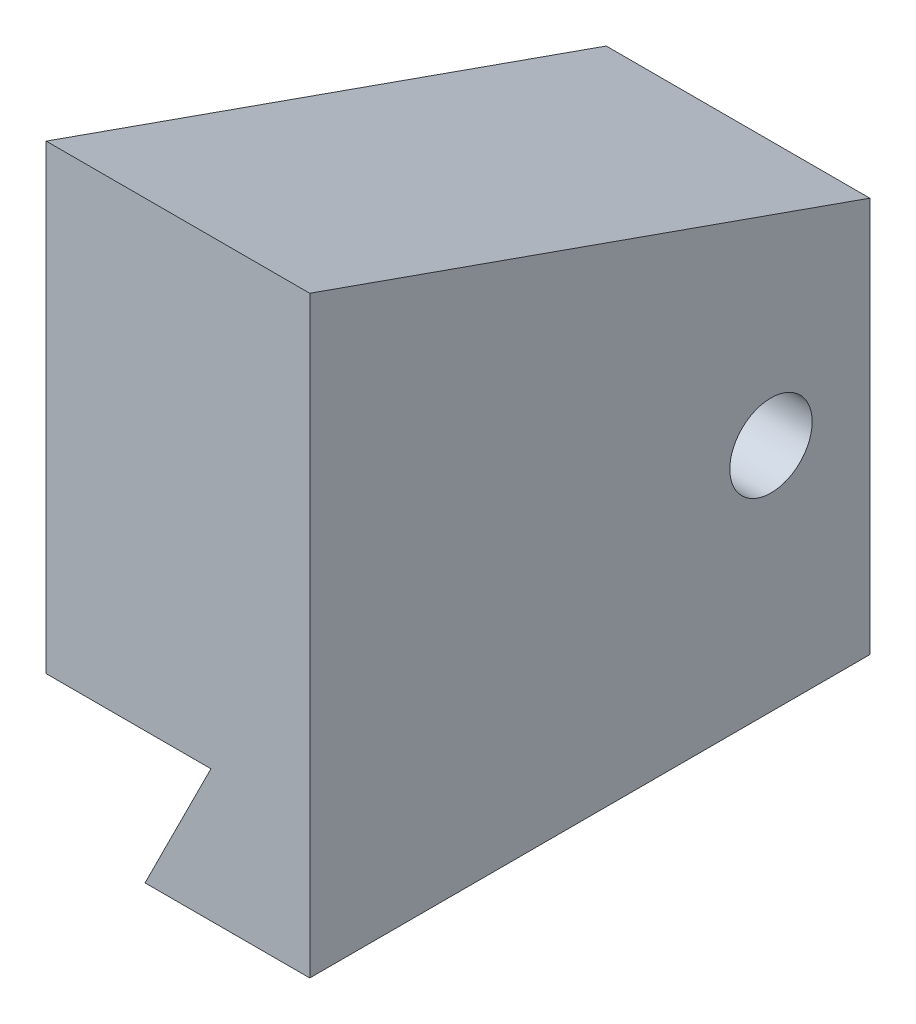
from build123d import *

# Parameters (mm, degrees)
BOSS_EXTRUDE1_DEPTH   = 8
CUT_EXTRUDE2_DEPTH    = 27.019223663
M3X0_5_TAPPED_HOLE1_D = 2.5
SKETCH7_W             = 20.825163494
SKETCH7_H             = 21.535112249
CUT_EXTRUDE3_DEPTH    = 8


with BuildPart() as part:
    # Sketch1 → Boss-Extrude1 (new body)
    with BuildSketch(Plane(origin=(0, 0, 0), x_dir=(0, 0, -1), z_dir=(1, 0, 0))):
        Polygon((0, 0), (0, 12), (-17, 18), (-17, 0), align=None)
    boss_extrude1 = extrude(amount=BOSS_EXTRUDE1_DEPTH)

    # Sketch3 → Cut-Extrude2 (cut, through all)
    with BuildSketch(Plane(origin=(0, 0, 0), x_dir=(-1, 0, 0), z_dir=(0, 0, -1))):
        Polygon((-8, 0), (-5, 0), (-3, 4), (-8, 4), align=None)
    cut_extrude2 = extrude(amount=-CUT_EXTRUDE2_DEPTH, mode=Mode.SUBTRACT)

    # M3x0.5 Tapped Hole1 (through all)
    with Locations(Plane(origin=(8, 7, 3), x_dir=(0, 0, 1), z_dir=(1, 0, 0))):
        with Locations((0, 0)):
            m3x0_5_tapped_hole1 = Hole(M3X0_5_TAPPED_HOLE1_D / 2)

    # Mirror1: Boss-Extrude1, Cut-Extrude2, M3x0.5 Tapped Hole1 across plane
    add(boss_extrude1.mirror(Plane(origin=(0, 0, 0), x_dir=(0, 0, 1), z_dir=(1, 0, 0))))
    add(cut_extrude2.mirror(Plane(origin=(0, 0, 0), x_dir=(0, 0, 1), z_dir=(1, 0, 0))), mode=Mode.SUBTRACT)
    add(m3x0_5_tapped_hole1.mirror(Plane(origin=(0, 0, 0), x_dir=(0, 0, 1), z_dir=(1, 0, 0))), mode=Mode.SUBTRACT)

    # Sketch7 → Cut-Extrude3 (cut)
    with BuildSketch(Plane(origin=(8, 0, 0), x_dir=(0, 0, -1), z_dir=(1, 0, 0))):
        with Locations((-8.18446722, 8.52670083)):
            Rectangle(SKETCH7_W, SKETCH7_H)
    extrude(amount=-CUT_EXTRUDE3_DEPTH, mode=Mode.SUBTRACT)


solid = part.part
